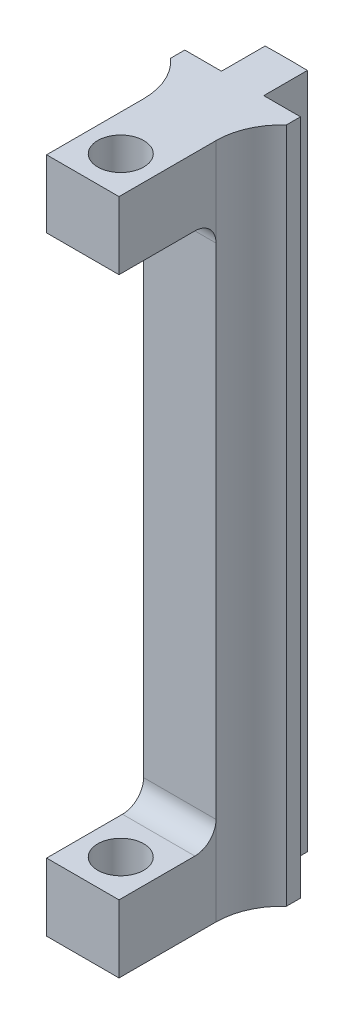
from build123d import *

# Parameters (mm, degrees)
BOSS_EXTRUDE1_DEPTH   = 50.8
CUT_EXTRUDE1_DEPTH    = 99.34985718
SKETCH2_W             = 5.436248728
SKETCH2_H             = 7.283946563
BOSS_EXTRUDE2_DEPTH   = 5.08
FILLET1_R             = 1.5875
FILLET1_OF_MIRROR1_R  = 1.5875
F_4_CLEARANCE_HOLE1_D = 3.4544


with BuildPart() as part:
    # Sketch1 → Boss-Extrude1 (new body)
    with BuildSketch(Plane(origin=(0, 0, 0), x_dir=(1, 0, 0), z_dir=(0, 1, 0))):
        with BuildLine():
            Line((-2.718124364, 75.815452903), (2.718124364, 75.815452903))
            ThreePointArc((2.718124364, 75.815452903), (4.340809806, 79.470419596), (8.140147873, 80.718185524))
            Line((8.140147873, 80.718185524), (8.140147873, 83.423799917))
            ThreePointArc((8.140147873, 83.423799917), (0, 83.82), (-8.140147873, 83.423799917))
            Line((-8.140147873, 83.423799917), (-8.140147873, 80.718185524))
            ThreePointArc((-8.140147873, 80.718185524), (-4.340809806, 79.470419596), (-2.718124364, 75.815452903))
        make_face()
    extrude(amount=-BOSS_EXTRUDE1_DEPTH)

    # Sketch3 → Cut-Extrude1 (cut, through all)
    with BuildSketch(Plane(origin=(0, 0, 0), x_dir=(1, 0, 0), z_dir=(0, 1, 0))):
        Polygon((37.412226228, 86.104380481), (-3.175, 86.104380481), (-9.73961955, 86.104380481), (-9.73961955, 76.768037091), (-4.340809806, 76.768037091), (-4.340809806, 80.528090721), (-1.5875, 80.528090721), (-1.5875, 83.82), (0, 83.82), (40.587226228, 83.82), (87.99570433, 149.711789591), (84.82070433, 151.996170072), align=None)
    cut_extrude1 = extrude(amount=-CUT_EXTRUDE1_DEPTH, mode=Mode.SUBTRACT)

    # Mirror2: Cut-Extrude1 across plane
    add(cut_extrude1.mirror(Plane(origin=(0, 0, 0), x_dir=(0, 0, 1), z_dir=(1, 0, 0))), mode=Mode.SUBTRACT)

    # Sketch2 → Boss-Extrude2 (add)
    with BuildSketch(Plane(origin=(0, 0, 0), x_dir=(1, 0, 0), z_dir=(0, 1, 0))):
        with Locations((0, 72.173479622)):
            Rectangle(SKETCH2_W, SKETCH2_H)
    boss_extrude2 = extrude(amount=-BOSS_EXTRUDE2_DEPTH)

    # Fillet1
    fillet1_edges = [part.edges().sort_by_distance(p)[0] for p in [
        (0, -5.08, -75.815452903),
    ]]
    fillet(fillet1_edges, radius=FILLET1_R)

    # Mirror1: Boss-Extrude2 across plane
    add(boss_extrude2.mirror(Plane(origin=(0, -25.4, 0), x_dir=(0, 0, 1), z_dir=(0, -1, 0))))

    # Fillet1 of Mirror1
    fillet1_of_mirror1_edges = [part.edges().sort_by_distance(p)[0] for p in [
        (0, -45.72, -75.815452903),
    ]]
    fillet(fillet1_of_mirror1_edges, radius=FILLET1_OF_MIRROR1_R)

    # #4 Clearance Hole1 (through all)
    with Locations(Plane(origin=(0, 0, 0), x_dir=(1, 0, 0), z_dir=(0, 1, 0))):
        with Locations((0, 71.379729622)):
            Hole(F_4_CLEARANCE_HOLE1_D / 2)


solid = part.part
